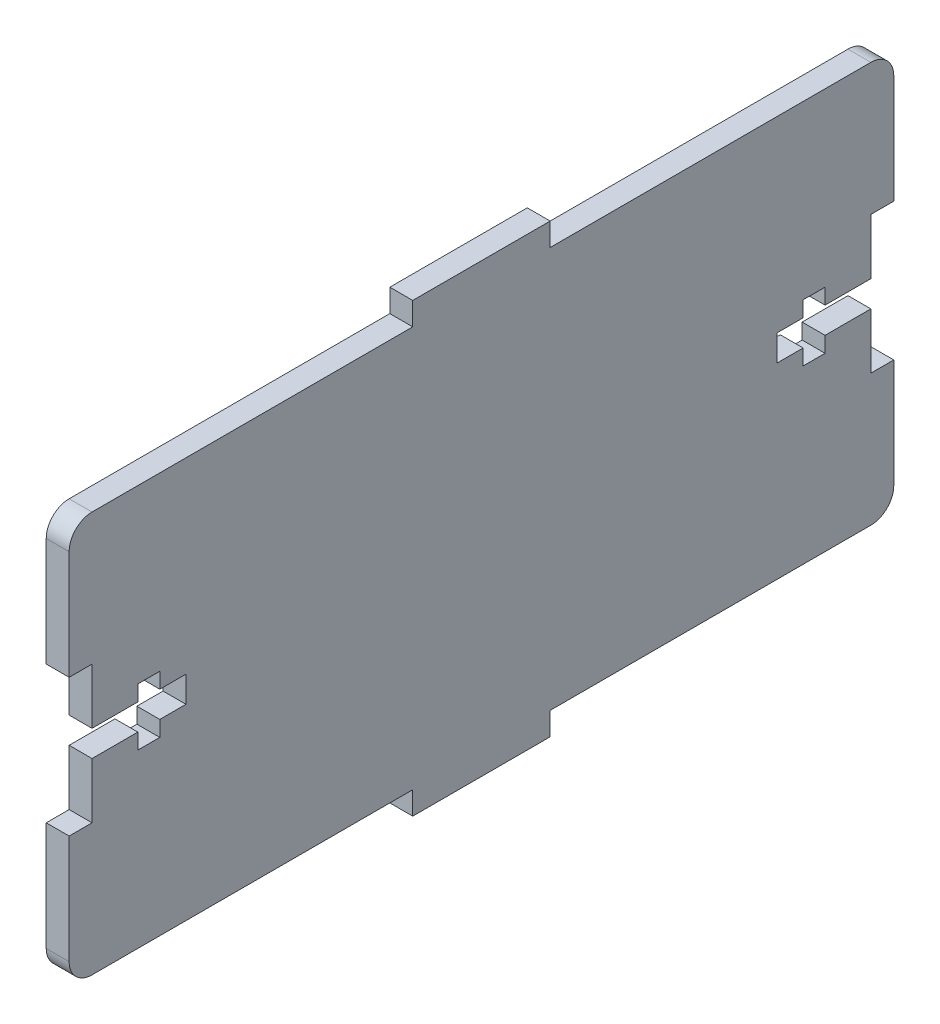
from build123d import *

# Parameters (mm, degrees)
BOSS_EXTRUDE1_DEPTH = 2.54
FILLET1_R           = 2.54


with BuildPart() as part:
    # Sketch2 → Boss-Extrude1 (new body)
    with BuildSketch(Plane(origin=(0, 0, 0), x_dir=(0, 0, -1), z_dir=(1, 0, 0))):
        Polygon((-45.72, 22.225), (-45.72, 7.62), (-43.18, 7.62), (-43.18, 1.4478), (-38.1, 1.4478), (-38.1, 3.175), (-35.66795, 3.175), (-35.66795, 1.4478), (-32.766, 1.4478), (-32.766, -1.4478), (-35.66795, -1.4478), (-35.66795, -3.175), (-38.1, -3.175), (-38.1, -1.4478), (-43.18, -1.4478), (-43.18, -7.62), (-45.72, -7.62), (-45.72, -22.225), (-7.62, -22.225), (-7.62, -24.765), (7.62, -24.765), (7.62, -22.225), (45.72, -22.225), (45.72, -7.62), (43.18, -7.62), (43.18, -1.4478), (38.1, -1.4478), (38.1, -3.175), (35.66795, -3.175), (35.66795, -1.4478), (32.766, -1.4478), (32.766, 1.4478), (35.66795, 1.4478), (35.66795, 3.175), (38.1, 3.175), (38.1, 1.4478), (43.18, 1.4478), (43.18, 7.62), (45.72, 7.62), (45.72, 22.225), (7.62, 22.225), (7.62, 24.765), (-7.62, 24.765), (-7.62, 22.225), align=None)
    extrude(amount=BOSS_EXTRUDE1_DEPTH)

    # Fillet1
    fillet1_edges = [part.edges().sort_by_distance(p)[0] for p in [
        (1.27, -22.225, -45.72),
        (1.27, -22.225, 45.72),
        (1.27, 22.225, 45.72),
        (1.27, 22.225, -45.72),
    ]]
    fillet(fillet1_edges, radius=FILLET1_R)


solid = part.part
